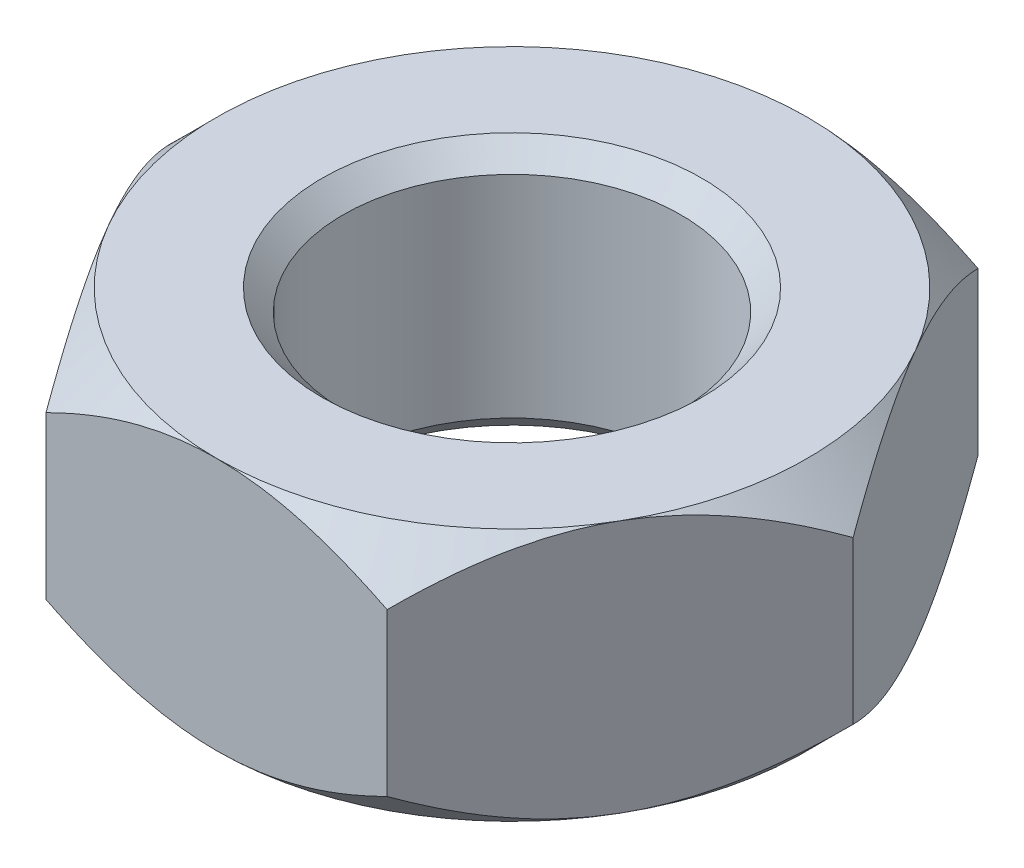
from build123d import *

# Parameters (mm, degrees)
SKETCH1_R           = 2
BOSS_EXTRUDE1_DEPTH = 3
CHAMFER2_SIZE       = 0.25


with BuildPart() as part:
    # Sketch1 → Boss-Extrude1 (new body)
    with BuildSketch(Plane(origin=(0, 0, 0), x_dir=(1, 0, 0), z_dir=(0, 1, 0))):
        Polygon((2.020725942, -3.5), (4.041451884, 0), (2.020725942, 3.5), (-2.020725942, 3.5), (-4.041451884, 0), (-2.020725942, -3.5), align=None)
        Circle(SKETCH1_R, mode=Mode.SUBTRACT)
    extrude(amount=BOSS_EXTRUDE1_DEPTH)

    # Sketch2 → Cut-Revolve1 (revolve, cut)
    with BuildSketch(Plane(origin=(0, 0, 0), x_dir=(0, 0, -1), z_dir=(1, 0, 0))):
        Polygon((3.5, 3), (4.55, 4.05), (4.55, 1.95), align=None)
        Polygon((4.55, 1.05), (3.5, 0), (4.55, -1.05), align=None)
    revolve(axis=Axis((0, 3, 0), (0, -1, 0)), mode=Mode.SUBTRACT)

    # Chamfer2
    chamfer2_edges = [part.edges().sort_by_distance(p)[0] for p in [
        (-2, 3, 0),
        (-2, 0, 0),
    ]]
    chamfer(chamfer2_edges, length=CHAMFER2_SIZE)


solid = part.part
